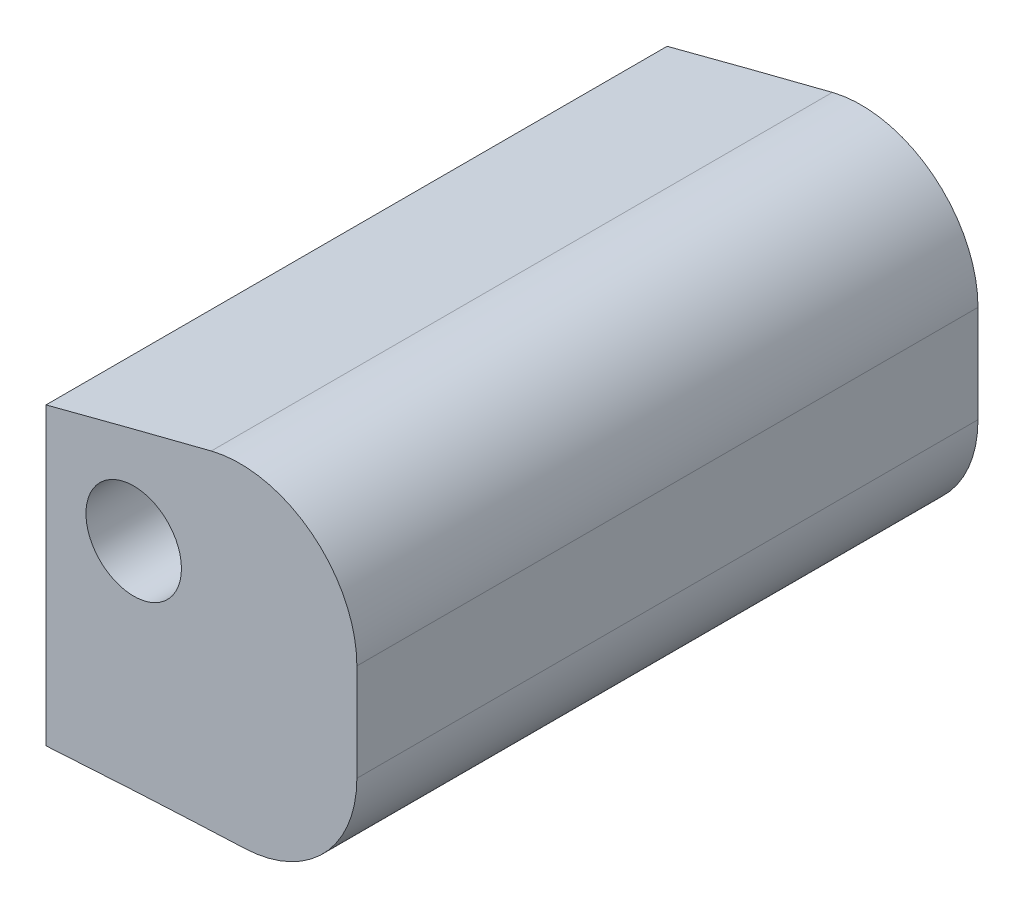
from build123d import *

# Parameters (mm, degrees)
SKETCH1_R           = 2.075
BOSS_EXTRUDE1_DEPTH = 26.9875
SKETCH2_W           = 86.364255874
SKETCH2_H           = 34.814742066
CUT_EXTRUDE1_DEPTH  = 47.713127442


with BuildPart() as part:
    # Sketch1 → Boss-Extrude1 (new body)
    with BuildSketch(Plane.XY):
        with BuildLine():
            Line((36.087463381, 2.999957931), (36.087463381, 7.227968589))
            ThreePointArc((36.087463381, 7.227968589), (34.127671177, 11.236796761), (29.760414833, 12.152526428))
            add(Edge.make_bspline(
                [(29.760414833, 12.152526428), (20.104550549, 9.70736649), (4.160634919, 5.361227781), (-17.353300331, -1.599332571), (-25.573599276, -4.860049738), (-35.772390435, -8.549078563), (-32.029323662, -8.160268468)],
                knots=[0.330745029, 0.330745029, 0.330745029, 0.330745029, 0.630725311, 0.824213609, 0.940085477, 1, 1, 1, 1], degree=3))
            add(Edge.make_bspline(
                [(-32.029323662, -8.160268468), (-27.594277811, -7.052683566), (-20.08844374, -6.583461174), (-6.740332369, -4.760965275), (4.869732234, -4.072592428), (18.49447741, -2.742713062), (26.204740163, -2.287162162), (31.22157185, -2.075528013)],
                knots=[0, 0, 0, 0, 0.144322392, 0.237947652, 0.42712275, 0.512831912, 0.67202474, 0.67202474, 0.67202474, 0.67202474], degree=3))
            ThreePointArc((31.22157185, -2.075528013), (34.674483358, -0.515630852), (36.087463381, 2.999957931))
        make_face()
        with Locations((26.390676338, 7.079731532)):
            Circle(SKETCH1_R, mode=Mode.SUBTRACT)
    extrude(amount=BOSS_EXTRUDE1_DEPTH)

    # Sketch2 → Cut-Extrude1 (cut, through all)
    with BuildSketch(Plane.XY.offset(26.9875)):
        with Locations((-20.601451599, -3.276083686)):
            Rectangle(SKETCH2_W, SKETCH2_H)
    extrude(amount=-CUT_EXTRUDE1_DEPTH, mode=Mode.SUBTRACT)


solid = part.part
